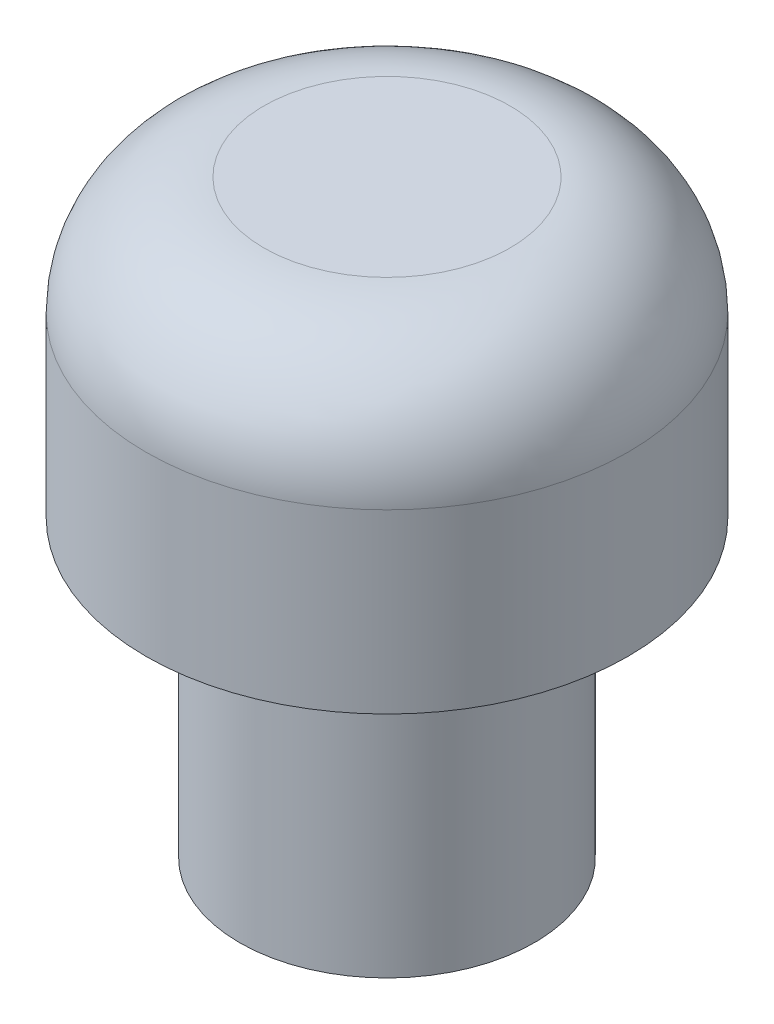
from build123d import *

# Parameters (mm, degrees)
SKETCH1_R           = 3.175
BOSS_EXTRUDE1_DEPTH = 6.35
SKETCH2_R           = 5.192013169
BOSS_EXTRUDE2_DEPTH = 6.35
FILLET1_R           = 2.54


with BuildPart() as part:
    # Sketch1 → Boss-Extrude1 (new body)
    with BuildSketch(Plane(origin=(0, 0, 0), x_dir=(1, 0, 0), z_dir=(0, 1, 0))):
        with Locations(Location((0, 0, 0), (0, 0, 270))):
            Circle(SKETCH1_R)
    extrude(amount=BOSS_EXTRUDE1_DEPTH)

    # Sketch2 → Boss-Extrude2 (add)
    with BuildSketch(Plane(origin=(0, 6.35, 0), x_dir=(1, 0, 0), z_dir=(0, 1, 0))):
        with Locations(Location((0, 0, 0), (0, 0, 270))):
            Circle(SKETCH2_R)
    extrude(amount=BOSS_EXTRUDE2_DEPTH)

    # Fillet1
    fillet1_edges = [part.edges().sort_by_distance(p)[0] for p in [
        (0, 12.7, -5.192013169),
    ]]
    fillet(fillet1_edges, radius=FILLET1_R)


solid = part.part
